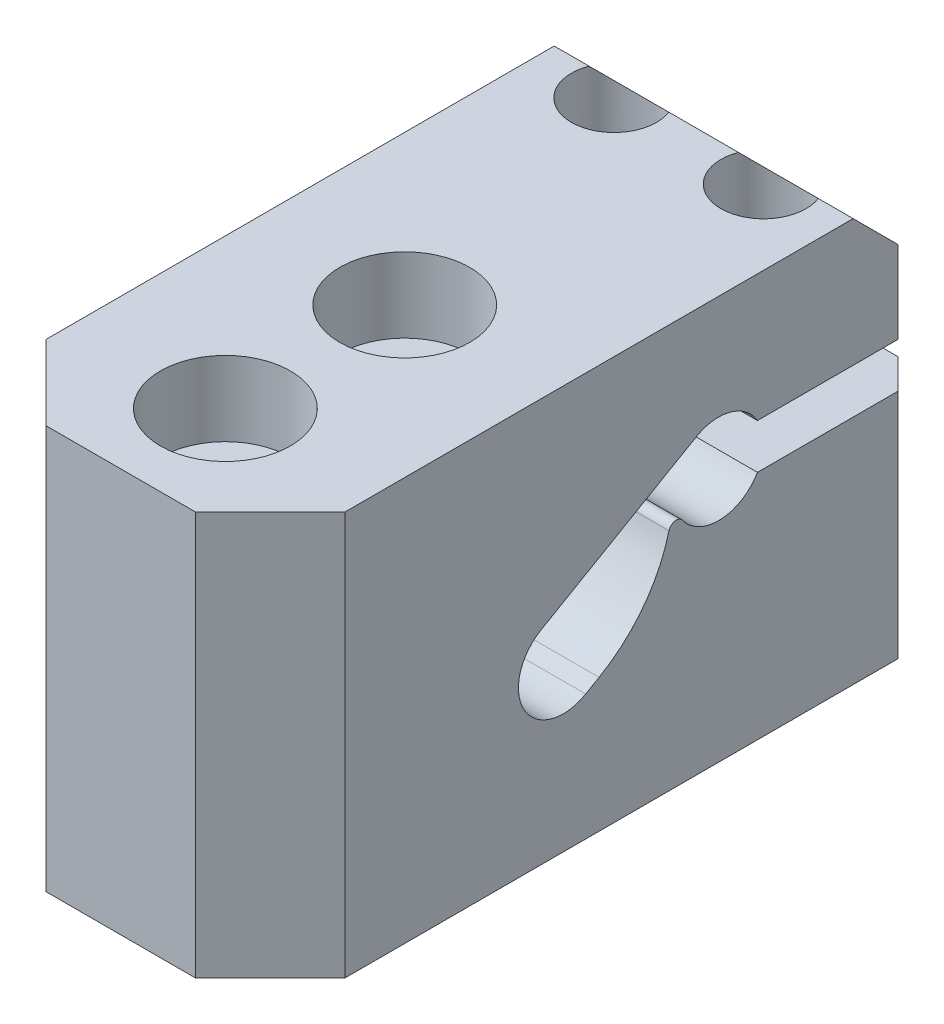
from build123d import *

# Parameters (mm, degrees)
EXTRUDE_1_DEPTH     = 20
FILLET_1_R          = 10
FILLET_2_R          = 0.5
SKETCH_2_R          = 4.35
SKETCH_2_R_2        = 2.5
CUT_EXTRUDE_1_DEPTH = 5
SKETCH_2_3_R        = 2.85
SKETCH_2_3_R_2      = 1.5
CUT_EXTRUDE_2_DEPTH = 5
SKETCH_2_4_R        = 2.5
SKETCH_2_4_R_2      = 1.5
CUT_EXTRUDE_3_DEPTH = 46.044422689
CHAMFER_1_SIZE      = 5
CHAMFER_2_SIZE      = 2


with BuildPart() as part:
    # 스케치1 → 보스-돌출1 (new body)
    with BuildSketch(Plane(origin=(0, 0, 0), x_dir=(0, 0, -1), z_dir=(1, 0, 0))):
        with BuildLine():
            ThreePointArc((-8.892304845, -8.598076211), (-12.990381057, -7.5), (-11.892304845, -3.401923789))
            Line((-11.892304845, -3.401923789), (-1.5, 2.598076211))
            ThreePointArc((-1.5, 2.598076211), (0.776457135, 2.897777479), (2.598076211, 1.5))
            Line((2.598076211, 1.5), (14, 1.5))
            Line((14, 1.5), (14, 5))
            Line((14, 5), (9, 10))
            Line((9, 10), (-30, 10))
            Line((-30, 10), (-30, -17))
            Line((-30, -17), (14, -17))
            Line((14, -17), (14, -1.5))
            Line((14, -1.5), (2.598076211, -1.5))
            ThreePointArc((2.598076211, -1.5), (-0.776457135, -2.897777479), (-3, 0))
            Line((-3, 0), (-3.62758528, -5.558488953))
            Line((-3.62758528, -5.558488953), (-8.892304845, -8.598076211))
        make_face()
    extrude(amount=EXTRUDE_1_DEPTH)

    # 필렛1
    fillet_1_edges = [part.edges().sort_by_distance(p)[0] for p in [
        (10, -5.558488953, 3.62758528),
    ]]
    fillet(fillet_1_edges, radius=FILLET_1_R)

    # 필렛2
    fillet_2_edges = [part.edges().sort_by_distance(p)[0] for p in [
        (10, 0, 3),
    ]]
    fillet(fillet_2_edges, radius=FILLET_2_R)

    # 스케치2 → 컷-돌출1 (cut)
    # profile 1 of 2: a face of its own
    with BuildSketch(Plane(origin=(0, 10, 0), x_dir=(1, 0, 0), z_dir=(0, 1, 0))):
        with Locations((10, -11)):
            Circle(SKETCH_2_R)
        with Locations((10, -11)):
            Circle(SKETCH_2_R_2, mode=Mode.SUBTRACT)
    # profile 2 of 2: a face of its own
    with BuildSketch(Plane(origin=(0, 10, 0), x_dir=(1, 0, 0), z_dir=(0, 1, 0))):
        with Locations((10, -23)):
            Circle(SKETCH_2_R)
        with Locations((10, -23)):
            Circle(SKETCH_2_R_2, mode=Mode.SUBTRACT)
    extrude(amount=-CUT_EXTRUDE_1_DEPTH, mode=Mode.SUBTRACT)

    # 스케치2<3> → 컷-돌출2 (cut)
    # profile 1 of 2: a face of its own
    with BuildSketch(Plane(origin=(0, 10, 0), x_dir=(1, 0, 0), z_dir=(0, 1, 0))):
        with Locations((5, 8)):
            Circle(SKETCH_2_3_R)
        with Locations((5, 8)):
            Circle(SKETCH_2_3_R_2, mode=Mode.SUBTRACT)
    # profile 2 of 2: a face of its own
    with BuildSketch(Plane(origin=(0, 10, 0), x_dir=(1, 0, 0), z_dir=(0, 1, 0))):
        with Locations((15, 8)):
            Circle(SKETCH_2_3_R)
        with Locations((15, 8)):
            Circle(SKETCH_2_3_R_2, mode=Mode.SUBTRACT)
    extrude(amount=-CUT_EXTRUDE_2_DEPTH, mode=Mode.SUBTRACT)

    # 스케치2<4> → 컷-돌출3 (cut, through all)
    with BuildSketch(Plane(origin=(0, 10, 0), x_dir=(1, 0, 0), z_dir=(0, 1, 0))):
        with Locations((10, -11)):
            Circle(SKETCH_2_4_R)
        with Locations((15, 8)):
            Circle(SKETCH_2_4_R_2)
        with Locations((5, 8)):
            Circle(SKETCH_2_4_R_2)
        with Locations((10, -23)):
            Circle(SKETCH_2_4_R)
    extrude(amount=-CUT_EXTRUDE_3_DEPTH, mode=Mode.SUBTRACT)

    # 모따기1
    chamfer_1_edges = [part.edges().sort_by_distance(p)[0] for p in [
        (20, -3.5, 30),
        (0, -3.5, 30),
    ]]
    chamfer(chamfer_1_edges, length=CHAMFER_1_SIZE)

    # 모따기2
    chamfer_2_edges = [part.edges().sort_by_distance(p)[0] for p in [
        (0, -9.25, -14),
        (0, 3.25, -14),
        (20, 3.25, -14),
        (20, -9.25, -14),
    ]]
    chamfer(chamfer_2_edges, length=CHAMFER_2_SIZE)


solid = part.part
